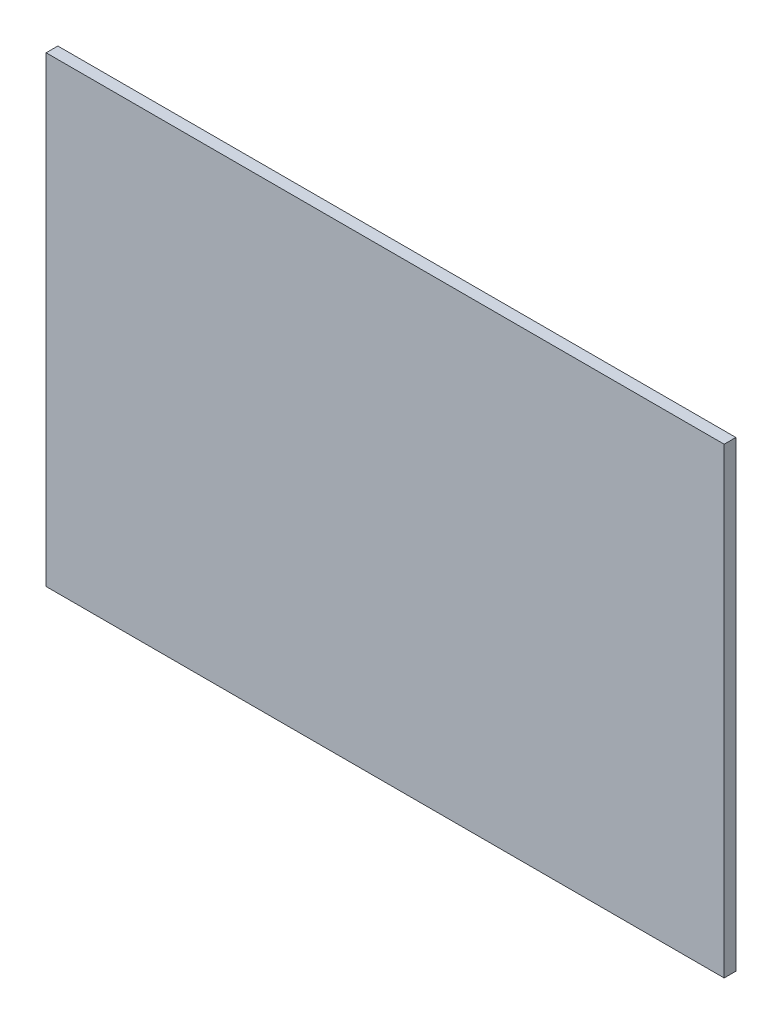
from build123d import *

# Parameters (mm, degrees)
SKETCH1_W           = 279.4
SKETCH1_H           = 190.5
BOSS_EXTRUDE1_DEPTH = 4.826


with BuildPart() as part:
    # Sketch1 → Boss-Extrude1 (new body)
    with BuildSketch(Plane.XY):
        Rectangle(SKETCH1_W, SKETCH1_H)
    extrude(amount=BOSS_EXTRUDE1_DEPTH)


solid = part.part
